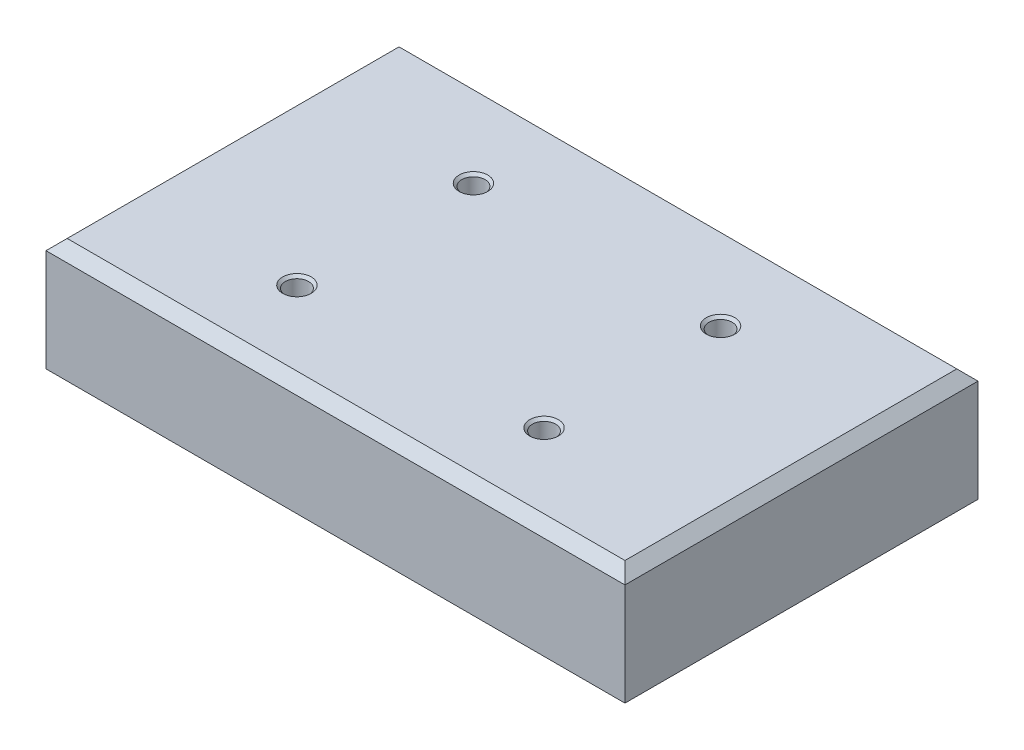
from build123d import *

# Parameters (mm, degrees)
SKETCH1_W                   = 82
SKETCH1_H                   = 50
BOSS_EXTRUDE1_DEPTH         = 16
M4_TAPPED_HOLE2_D           = 3.3
M4_TAPPED_HOLE2_DEPTH       = 8
M4_TAPPED_HOLE2_CSINK_D     = 4.05
M4_TAPPED_HOLE2_CSINK_ANGLE = 90
M4_TAPPED_HOLE2_TIP         = 0.991420021
CHAMFER1_SIZE               = 1.5


with BuildPart() as part:
    # Sketch1 → Boss-Extrude1 (new body)
    with BuildSketch(Plane(origin=(0, 0, 0), x_dir=(1, 0, 0), z_dir=(0, 1, 0))):
        Rectangle(SKETCH1_W, SKETCH1_H)
    extrude(amount=BOSS_EXTRUDE1_DEPTH)

    # M4 Tapped Hole2
    with Locations(Plane(origin=(0, 16, 0), x_dir=(1, 0, 0), z_dir=(0, 1, 0))):
        with Locations((-17.5, 12.03939534), (17.5, 12.03939534), (17.5, -12.96060466), (-17.5, -12.96060466)):
            CounterSinkHole(M4_TAPPED_HOLE2_D / 2, M4_TAPPED_HOLE2_CSINK_D / 2, depth=M4_TAPPED_HOLE2_DEPTH, counter_sink_angle=M4_TAPPED_HOLE2_CSINK_ANGLE)
            with Locations((0, 0, -(M4_TAPPED_HOLE2_DEPTH + M4_TAPPED_HOLE2_TIP / 2))):  # 118° drill point
                Cone(0, M4_TAPPED_HOLE2_D / 2, M4_TAPPED_HOLE2_TIP, mode=Mode.SUBTRACT)

    # Chamfer1
    chamfer1_edges = [part.edges().sort_by_distance(p)[0] for p in [
        (-41, 16, 0),
        (0, 16, 25),
        (41, 16, 0),
        (0, 16, -25),
    ]]
    chamfer(chamfer1_edges, length=CHAMFER1_SIZE)


solid = part.part
